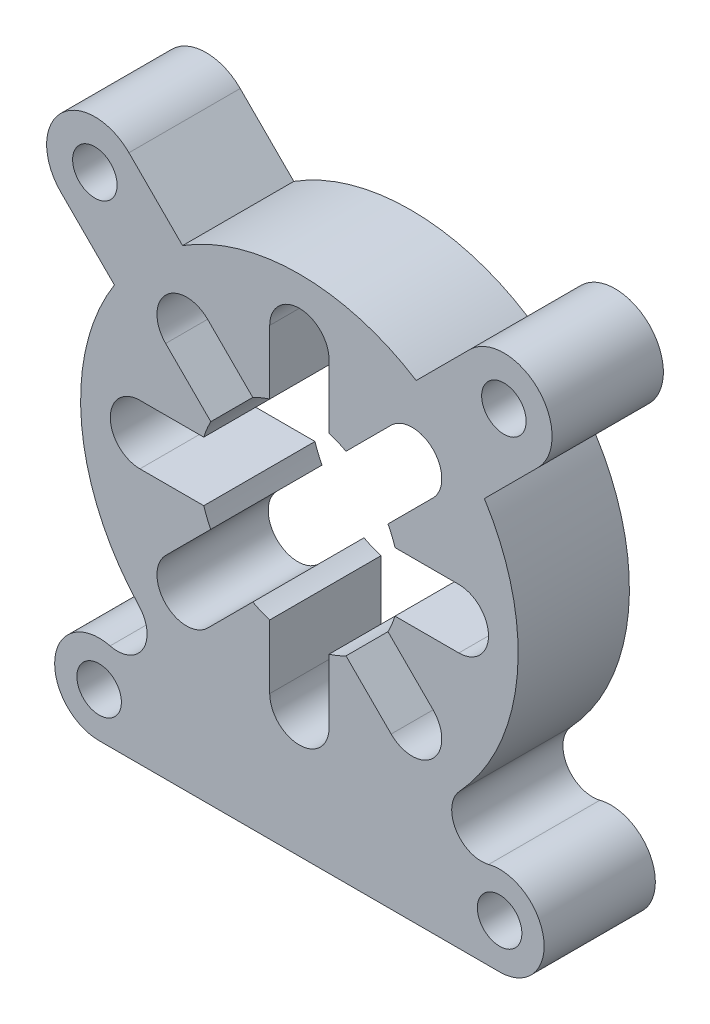
from build123d import *

# Parameters (mm, degrees)
CROQUIS1_R              = 6
SALIENTE_EXTRUIR2_DEPTH = 30


with BuildPart() as part:
    # Croquis1 → Saliente-Extruir2 (new body)
    # profile 1 of 2: a face of its own
    with BuildSketch(Plane.XY):
        with BuildLine():
            Line((45.961940777, 64.346717088), (31.501591743, 49.886368054))
            ThreePointArc((31.501591743, 49.886368054), (0, 59), (-31.501591743, 49.886368054))
            Line((-31.501591743, 49.886368054), (-45.961940777, 64.346717088))
            ThreePointArc((-45.961940777, 64.346717088), (-64.346717088, 64.346717088), (-64.346717088, 45.961940777))
            Line((-64.346717088, 45.961940777), (-49.886368054, 31.501591743))
            ThreePointArc((-49.886368054, 31.501591743), (0, -59), (49.886368054, 31.501591743))
            Line((49.886368054, 31.501591743), (64.346717088, 45.961940777))
            ThreePointArc((64.346717088, 45.961940777), (64.346717088, 64.346717088), (45.961940777, 64.346717088))
        make_face()
        with Locations((55.154328933, 55.154328933)):
            Circle(CROQUIS1_R, mode=Mode.SUBTRACT)
        with Locations((-55.154328933, 55.154328933)):
            Circle(CROQUIS1_R, mode=Mode.SUBTRACT)
        with BuildLine():
            ThreePointArc((12.577728279, 23.891436778), (10.332452674, 24.944747378), (8, 25.787593916))
            Line((8, 25.787593916), (8, 43))
            ThreePointArc((8, 43), (0, 51), (-8, 43))
            Line((-8, 43), (-8, 25.787593916))
            ThreePointArc((-8, 25.787593916), (-10.332452674, 24.944747378), (-12.577728279, 23.891436778))
            Line((-12.577728279, 23.891436778), (-24.748737342, 36.062445841))
            ThreePointArc((-24.748737342, 36.062445841), (-36.062445841, 36.062445841), (-36.062445841, 24.748737342))
            Line((-36.062445841, 24.748737342), (-23.891436778, 12.577728279))
            ThreePointArc((-23.891436778, 12.577728279), (-24.944747378, 10.332452674), (-25.787593916, 8))
            Line((-25.787593916, 8), (-43, 8))
            ThreePointArc((-43, 8), (-51, 0), (-43, -8))
            Line((-43, -8), (-25.787593916, -8))
            ThreePointArc((-25.787593916, -8), (-24.944747378, -10.332452674), (-23.891436778, -12.577728279))
            Line((-23.891436778, -12.577728279), (-36.062445841, -24.748737342))
            ThreePointArc((-36.062445841, -24.748737342), (-36.062445841, -36.062445841), (-24.748737342, -36.062445841))
            Line((-24.748737342, -36.062445841), (-12.577728279, -23.891436778))
            ThreePointArc((-12.577728279, -23.891436778), (-10.332452674, -24.944747378), (-8, -25.787593916))
            Line((-8, -25.787593916), (-8, -43))
            ThreePointArc((-8, -43), (0, -51), (8, -43))
            Line((8, -43), (8, -25.787593916))
            ThreePointArc((8, -25.787593916), (10.332452674, -24.944747378), (12.577728279, -23.891436778))
            Line((12.577728279, -23.891436778), (24.748737342, -36.062445841))
            ThreePointArc((24.748737342, -36.062445841), (36.062445841, -36.062445841), (36.062445841, -24.748737342))
            Line((36.062445841, -24.748737342), (23.891436778, -12.577728279))
            ThreePointArc((23.891436778, -12.577728279), (24.944747378, -10.332452674), (25.787593916, -8))
            Line((25.787593916, -8), (43, -8))
            ThreePointArc((43, -8), (51, 0), (43, 8))
            Line((43, 8), (25.787593916, 8))
            ThreePointArc((25.787593916, 8), (24.944747378, 10.332452674), (23.891436778, 12.577728279))
            Line((23.891436778, 12.577728279), (36.062445841, 24.748737342))
            ThreePointArc((36.062445841, 24.748737342), (36.062445841, 36.062445841), (24.748737342, 36.062445841))
            Line((24.748737342, 36.062445841), (12.577728279, 23.891436778))
        make_face(mode=Mode.SUBTRACT)
    # profile 2 of 2: a face of its own
    with BuildSketch(Plane.XY):
        with BuildLine():
            ThreePointArc((43.213377787, -40.16968982), (0, -59), (-43.213377787, -40.16968982))
            ThreePointArc((-43.213377787, -40.16968982), (-42.192314412, -49.697929449), (-51.043691305, -53.369856454))
            ThreePointArc((-51.043691305, -53.369856454), (-65.907176881, -63.510322611), (-54, -77))
            Line((-54, -77), (-0.009258466, -77))
            Line((-0.009258466, -77), (0.009258466, -77))
            Line((0.009258466, -77), (54, -77))
            ThreePointArc((54, -77), (65.907176881, -63.510322611), (51.043691305, -53.369856454))
            ThreePointArc((51.043691305, -53.369856454), (42.192314412, -49.697929449), (43.213377787, -40.16968982))
        make_face()
        with Locations((-54, -65)):
            Circle(CROQUIS1_R, mode=Mode.SUBTRACT)
        with Locations((54, -65)):
            Circle(CROQUIS1_R, mode=Mode.SUBTRACT)
    extrude(amount=SALIENTE_EXTRUIR2_DEPTH)


solid = part.part
